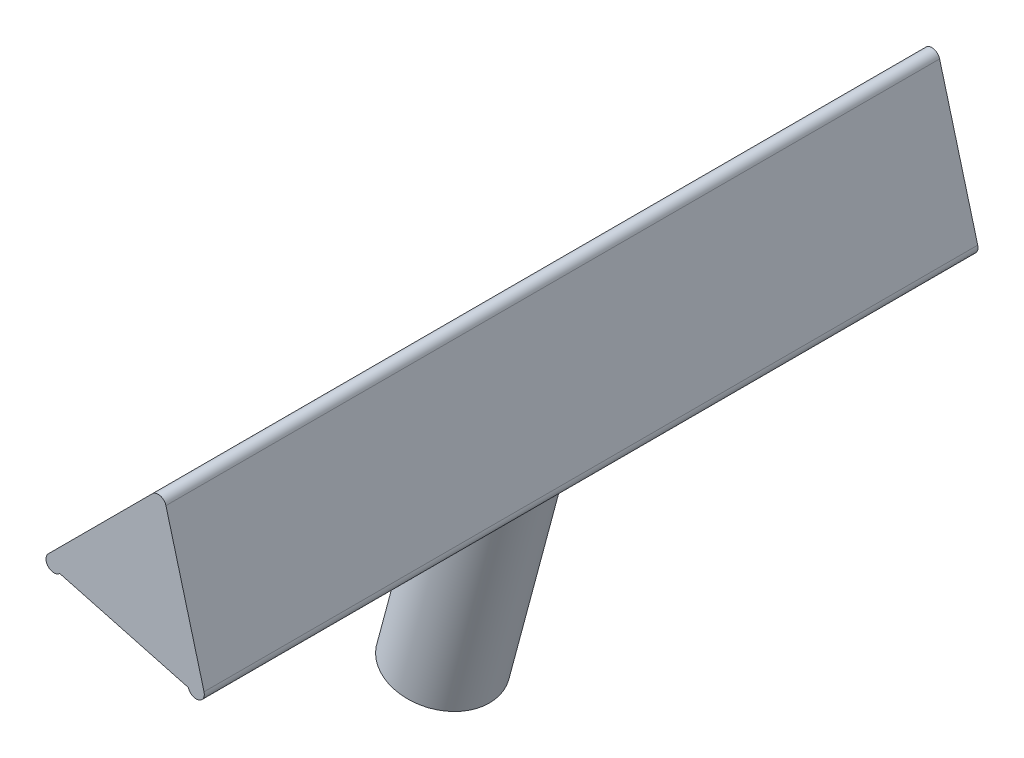
from build123d import *

# Parameters (mm, degrees)
BOSS_EXTRUDE1_DEPTH = 24
BOSS_EXTRUDE2_DEPTH = 48
SKETCH3_R           = 3
BOSS_EXTRUDE3_DEPTH = 16.34


with BuildPart() as part:
    # Sketch1 → Boss-Extrude1 (new, symmetric)
    with BuildSketch(Plane.XY):
        with BuildLine():
            Line((0, 0), (6.458695376, 6.458695376))
            ThreePointArc((6.458695376, 6.458695376), (6.941658289, 6.588104899), (7.29521168, 6.234551508))
            Line((7.29521168, 6.234551508), (9.659258263, -2.588190451))
            ThreePointArc((9.659258263, -2.588190451), (9.305704872, -3.200562887), (8.693332437, -2.847009496))
            Line((8.693332437, -2.847009496), (6.77757359, 4.302699856))
            ThreePointArc((6.77757359, 4.302699856), (6.424020199, 4.656253246), (5.941057286, 4.526843724))
            Line((5.941057286, 4.526843724), (0.707106781, -0.707106781))
            ThreePointArc((0.707106781, -0.707106781), (0, -0.707106781), (0, 0))
        make_face()
    extrude(amount=BOSS_EXTRUDE1_DEPTH, both=True)

    # Sketch2 → Boss-Extrude2 (add)
    with BuildSketch(Plane.XY.offset(24)):
        with BuildLine():
            Line((0.707106781, -0.707106781), (5.941057286, 4.526843724))
            ThreePointArc((5.941057286, 4.526843724), (6.424020199, 4.656253246), (6.77757359, 4.302699856))
            Line((6.77757359, 4.302699856), (8.693332437, -2.847009496))
            Line((8.693332437, -2.847009496), (0.707106781, -0.707106781))
        make_face()
    extrude(amount=-BOSS_EXTRUDE2_DEPTH)

    # Sketch3 → Boss-Extrude3 (add)
    with BuildSketch(Plane(origin=(-0.129409523, -0.482962913, 0), x_dir=(0.9659258262890683, -0.25881904510252096, 0), z_dir=(-0.25881904510252096, -0.9659258262890683, 0))):
        with Locations((5, 0)):
            Circle(SKETCH3_R)
    extrude(amount=BOSS_EXTRUDE3_DEPTH)


solid = part.part
